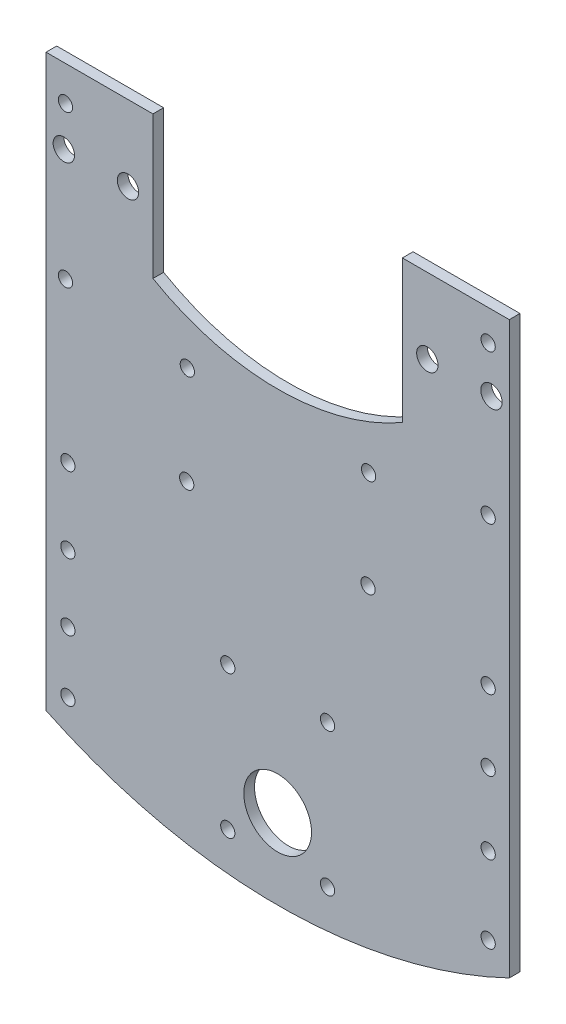
from build123d import *

# Parameters (mm, degrees)
SKETCH1_R           = 3
BOSS_EXTRUDE2_DEPTH = 3
SKETCH4_R           = 9.5
CUT_EXTRUDE2_DEPTH  = 10
SKETCH5_R           = 2
CUT_EXTRUDE3_DEPTH  = 3
SKETCH6_R           = 2
CUT_EXTRUDE4_DEPTH  = 3
SKETCH7_R           = 2
CUT_EXTRUDE5_DEPTH  = 10


with BuildPart() as part:
    # Sketch1 → Boss-Extrude2 (new body)
    with BuildSketch(Plane.XY):
        with BuildLine():
            Line((-34.17966517, 1.656542757), (-34.17966517, 41.656542757))
            Line((-34.17966517, 41.656542757), (-64.17966517, 41.656542757))
            Line((-64.17966517, 41.656542757), (-64.17966517, -118.343457243))
            ThreePointArc((-64.17966517, -118.343457243), (0.82033483, -133.158398897), (65.82033483, -118.343457243))
            Line((65.82033483, -118.343457243), (65.82033483, 41.656542757))
            Line((65.82033483, 41.656542757), (35.82033483, 41.656542757))
            Line((35.82033483, 41.656542757), (35.82033483, 1.656542757))
            ThreePointArc((35.82033483, 1.656542757), (0.82033483, -7.721678978), (-34.17966517, 1.656542757))
        make_face()
        with Locations((60.82033483, 20.554474708)):
            Circle(SKETCH1_R, mode=Mode.SUBTRACT)
        with Locations((42.82033483, 20.554474708)):
            Circle(SKETCH1_R, mode=Mode.SUBTRACT)
        with Locations(Location((-59.17966517, 20.554474708, 0), (0, 0, 180))):
            Circle(SKETCH1_R, mode=Mode.SUBTRACT)
        with Locations(Location((-41.17966517, 20.554474708, 0), (0, 0, 180))):
            Circle(SKETCH1_R, mode=Mode.SUBTRACT)
    extrude(amount=BOSS_EXTRUDE2_DEPTH)

    # Sketch4 → Cut-Extrude2 (cut)
    with BuildSketch(Plane.XY.offset(3)):
        with Locations((0.82033483, -110.721678978)):
            Circle(SKETCH4_R)
    extrude(amount=-CUT_EXTRUDE2_DEPTH, mode=Mode.SUBTRACT)

    # Sketch5 → Cut-Extrude3 (cut)
    with BuildSketch(Plane(origin=(0, 0, 0), x_dir=(-1, 0, 0), z_dir=(0, 0, -1))):
        with Locations((-14.82033483, -121.721678978)):
            Circle(SKETCH5_R)
        with Locations((-14.82033483, -81.721678978)):
            Circle(SKETCH5_R)
        with Locations((13.17966517, -81.721678978)):
            Circle(SKETCH5_R)
        with Locations((13.17966517, -121.721678978)):
            Circle(SKETCH5_R)
    extrude(amount=-CUT_EXTRUDE3_DEPTH, mode=Mode.SUBTRACT)

    # Sketch6 → Cut-Extrude4 (cut)
    with BuildSketch(Plane(origin=(0, 0, 0), x_dir=(-1, 0, 0), z_dir=(0, 0, -1))):
        with Locations((-26.170124502, -42.870278614)):
            Circle(SKETCH6_R)
        with Locations((-26.339734066, -15.290278614)):
            Circle(SKETCH6_R)
        with Locations((24.529454842, -15.290278614)):
            Circle(SKETCH6_R)
        with Locations((24.699064406, -42.870278614)):
            Circle(SKETCH6_R)
    extrude(amount=-CUT_EXTRUDE4_DEPTH, mode=Mode.SUBTRACT)

    # Sketch7 → Cut-Extrude5 (cut)
    with BuildSketch(Plane.XY.offset(3)):
        with Locations((-58.050753667, -112.076170868)):
            Circle(SKETCH7_R)
        with Locations((-58.050753667, -94.961890213)):
            Circle(SKETCH7_R)
        with Locations((-58.050753667, -76.250276697)):
            Circle(SKETCH7_R)
        with Locations((-58.050753667, -55.028568685)):
            Circle(SKETCH7_R)
        with Locations((-58.735324893, -10.759629391)):
            Circle(SKETCH7_R)
        with Locations((-58.735324893, 31.901332055)):
            Circle(SKETCH7_R)
        with Locations((59.892687825, -112.115366711)):
            Circle(SKETCH7_R)
        with Locations((59.892687825, -90.405584769)):
            Circle(SKETCH7_R)
        with Locations((59.892687825, -70.121992882)):
            Circle(SKETCH7_R)
        with Locations((59.892687825, -50.255835401)):
            Circle(SKETCH7_R)
        with Locations((59.892687825, -8.825910752)):
            Circle(SKETCH7_R)
        with Locations((59.892687825, 33.03311017)):
            Circle(SKETCH7_R)
    extrude(amount=-CUT_EXTRUDE5_DEPTH, mode=Mode.SUBTRACT)


solid = part.part
